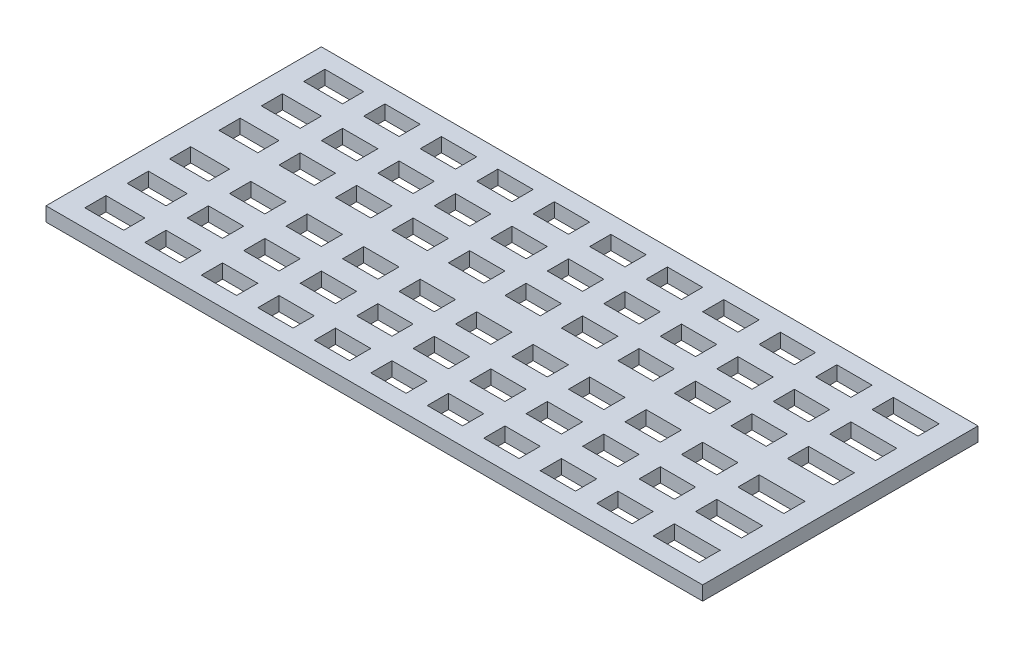
from build123d import *

# Parameters (mm, degrees)
SKETCH1_W           = 46.5
SKETCH1_H           = 19.5
BOSS_EXTRUDE1_DEPTH = 1
SKETCH2_W           = 43.5
SKETCH2_H           = 1.5
CUT_EXTRUDE1_DEPTH  = 1
SKETCH3_W           = 1.5
SKETCH3_H           = 17
BOSS_EXTRUDE2_DEPTH = 1


with BuildPart() as part:
    # Sketch1 → Boss-Extrude1 (new body)
    with BuildSketch(Plane(origin=(0, 0, 0), x_dir=(1, 0, 0), z_dir=(0, 1, 0))):
        Rectangle(SKETCH1_W, SKETCH1_H)
    extrude(amount=BOSS_EXTRUDE1_DEPTH)

    # Sketch2 → Cut-Extrude1 (cut)
    with BuildSketch(Plane(origin=(0, 1, 0), x_dir=(1, 0, 0), z_dir=(0, 1, 0))):
        with Locations((0, 7.75)):
            Rectangle(SKETCH2_W, SKETCH2_H)
        with Locations((0, 4.75)):
            Rectangle(SKETCH2_W, SKETCH2_H)
        with Locations((0, 1.75)):
            Rectangle(SKETCH2_W, SKETCH2_H)
        with Locations((0, -1.75)):
            Rectangle(SKETCH2_W, SKETCH2_H)
        with Locations((0, -4.75)):
            Rectangle(SKETCH2_W, SKETCH2_H)
        with Locations((0, -7.75)):
            Rectangle(SKETCH2_W, SKETCH2_H)
    extrude(amount=-CUT_EXTRUDE1_DEPTH, mode=Mode.SUBTRACT)

    # Sketch3 → Boss-Extrude2 (add)
    with BuildSketch(Plane(origin=(0, 1, 0), x_dir=(1, 0, 0), z_dir=(0, 1, 0))):
        with Locations((-18.25, 0)):
            Rectangle(SKETCH3_W, SKETCH3_H)
        with Locations((-14.25, 0)):
            Rectangle(SKETCH3_W, SKETCH3_H)
        with Locations((-10.25, 0)):
            Rectangle(SKETCH3_W, SKETCH3_H)
        with Locations((-6.25, 0)):
            Rectangle(SKETCH3_W, SKETCH3_H)
        with Locations((-2.25, 0)):
            Rectangle(SKETCH3_W, SKETCH3_H)
        with Locations((1.75, 0)):
            Rectangle(SKETCH3_W, SKETCH3_H)
        with Locations((5.75, 0)):
            Rectangle(SKETCH3_W, SKETCH3_H)
        with Locations((9.75, 0)):
            Rectangle(SKETCH3_W, SKETCH3_H)
        with Locations((13.75, 0)):
            Rectangle(SKETCH3_W, SKETCH3_H)
        with Locations((17.75, 0)):
            Rectangle(SKETCH3_W, SKETCH3_H)
    extrude(amount=-BOSS_EXTRUDE2_DEPTH)


solid = part.part
